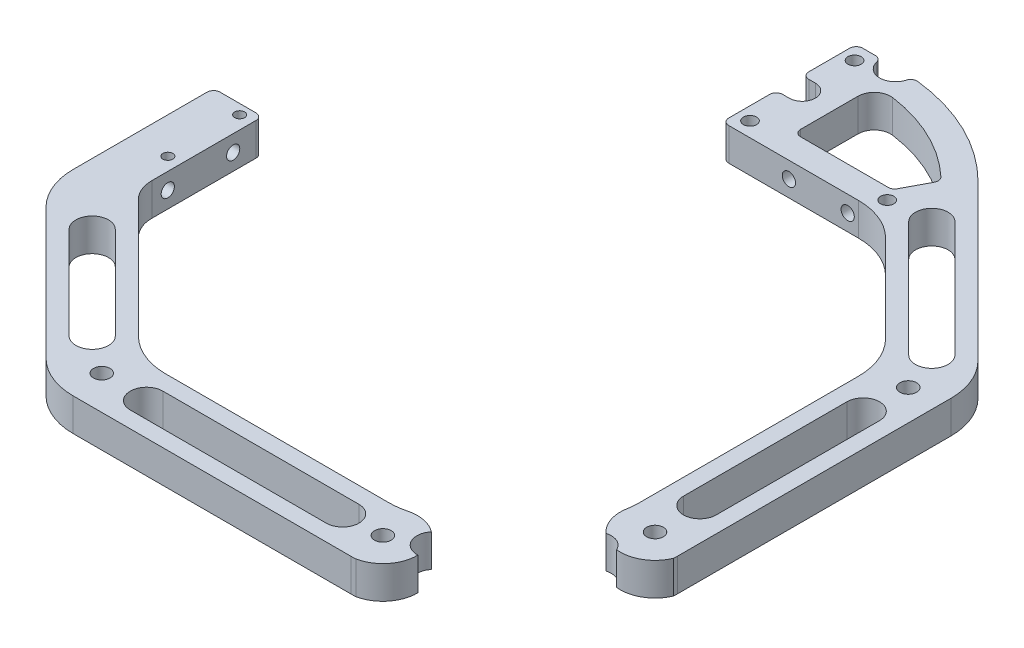
from build123d import *
from OCP.BRepFilletAPI import BRepFilletAPI_MakeFillet

# Parameters (mm, degrees)
EXTRUDE_1_DEPTH      = 5
FILLET_1_R1          = 10
FILLET_1_R2          = 20
FILLET_2_R1          = 20
FILLET_2_R2          = 60
FILLET_3_R           = 2
SKETCH_3_R           = 2.025
CUT_EXTRUDE_1_DEPTH  = 20
SKETCH_4_R           = 4.8
CUT_EXTRUDE_2_DEPTH  = 25
FILLET_4_R           = 2
SKETCH_5_R           = 1.525
CUT_EXTRUDE_3_DEPTH  = 20
CUT_EXTRUDE_4_DEPTH  = 20
CUT_EXTRUDE_5_DEPTH  = 20
FILLET_5_R           = 5
FILLET_6_R           = 2
SKETCH_8_R           = 2.55
CUT_EXTRUDE_6_DEPTH  = 25
SKETCH_9_R           = 2.025
CUT_EXTRUDE_7_DEPTH  = 17
CUT_EXTRUDE_START    = -10
CUT_EXTRUDE_10_DEPTH = 10
SKETCH_17_R          = 2.025
CUT_EXTRUDE_11_DEPTH = 8


with BuildPart() as part:
    # 草图2 → 凸台-拉伸1 (new, symmetric)
    with BuildSketch(Plane(origin=(0, 0, 0), x_dir=(1, 0, 0), z_dir=(0, 1, 0))):
        Polygon((0, -69), (0, -107), (45, -152), (130, -152), (160, -122), (160, -38.3), (121.7, 0), (71.7, 0), (71.7, 41), (108.984271247, 41), (180, -30.015728753), (180, -130.284271247), (138.284271247, -172), (36.715728753, -172), (-15, -120.284271247), (-15, -69), align=None)
    extrude(amount=EXTRUDE_1_DEPTH, both=True)

    # 圆角1: one fillet with a radius per group of edges: ONE call of the kernel's fillet builder (fillet() takes one radius for all edges)
    fillet_1_edges_1 = [part.edges().sort_by_distance(p)[0] for p in [
        (0, 0, 107),
    ]]
    fillet_1_edges_2 = [part.edges().sort_by_distance(p)[0] for p in [
        (45, 0, 152),
        (130, 0, 152),
        (160, 0, 122),
        (160, 0, 38.3),
        (121.7, 0, 0),
    ]]
    fillet_1 = BRepFilletAPI_MakeFillet(part.part.solid().wrapped)
    for e in fillet_1_edges_1:
        fillet_1.Add(FILLET_1_R1, e.wrapped)
    for e in fillet_1_edges_2:
        fillet_1.Add(FILLET_1_R2, e.wrapped)
    add(Compound.cast(fillet_1.Shape()), mode=Mode.REPLACE)

    # 圆角2: one fillet with a radius per group of edges: ONE call of the kernel's fillet builder (fillet() takes one radius for all edges)
    fillet_2_edges_1 = [part.edges().sort_by_distance(p)[0] for p in [
        (36.715728753, 0, 172),
        (-15, 0, 120.284271247),
        (138.284271247, 0, 172),
        (180, 0, 130.284271247),
        (180, 0, 30.015728753),
    ]]
    fillet_2_edges_2 = [part.edges().sort_by_distance(p)[0] for p in [
        (108.984271247, 0, -41),
    ]]
    fillet_2 = BRepFilletAPI_MakeFillet(part.part.solid().wrapped)
    for e in fillet_2_edges_1:
        fillet_2.Add(FILLET_2_R1, e.wrapped)
    for e in fillet_2_edges_2:
        fillet_2.Add(FILLET_2_R2, e.wrapped)
    add(Compound.cast(fillet_2.Shape()), mode=Mode.REPLACE)

    # 圆角3
    fillet_3_edges = [part.edges().sort_by_distance(p)[0] for p in [
        (71.7, 0, 0),
        (71.7, 0, -41),
        (-15, 0, 69),
        (0, 0, 69),
    ]]
    fillet(fillet_3_edges, radius=FILLET_3_R)

    # 草图3 → 切除-拉伸1 (cut, symmetric)
    with BuildSketch(Plane(origin=(0, 5, 0), x_dir=(1, 0, 0), z_dir=(0, 1, 0))):
        with Locations(Location((75.7, 4.5, 0), (0, 0, 90))):
            Circle(SKETCH_3_R)
        with Locations(Location((117.7, 4.5, 0), (0, 0, 90))):
            Circle(SKETCH_3_R)
        with Locations(Location((75.7, 36.5, 0), (0, 0, 90))):
            Circle(SKETCH_3_R)
    extrude(amount=CUT_EXTRUDE_1_DEPTH, both=True, mode=Mode.SUBTRACT)

    # 草图4 → 切除-拉伸2 (cut, symmetric)
    with BuildSketch(Plane(origin=(0, 5, 0), x_dir=(1, 0, 0), z_dir=(0, 1, 0))):
        with Locations((84.2, 40.5)):
            Circle(SKETCH_4_R)
        with BuildLine():
            Line((75.7, 24.5), (71.7, 24.5))
            Line((71.7, 24.5), (71.7, 16.5))
            Line((71.7, 16.5), (75.7, 16.5))
            ThreePointArc((75.7, 16.5), (79.7, 20.5), (75.7, 24.5))
        make_face()
    extrude(amount=CUT_EXTRUDE_2_DEPTH, both=True, mode=Mode.SUBTRACT)

    # 圆角4
    fillet_4_edges = [part.edges().sort_by_distance(p)[0] for p in [
        (88.990431478, 0, -40.802929459),
        (79.426112695, 0, -41),
        (71.7, 0, -16.5),
        (71.7, 0, -24.5),
    ]]
    fillet(fillet_4_edges, radius=FILLET_4_R)

    # 草图5 → 切除-拉伸3 (cut, symmetric)
    with BuildSketch(Plane.XZ.offset(5)):
        with Locations(Location((-4, 72, 0), (0, 0, 270))):
            Circle(SKETCH_5_R)
        with Locations(Location((-4, 94, 0), (0, 0, 270))):
            Circle(SKETCH_5_R)
    extrude(amount=CUT_EXTRUDE_3_DEPTH, both=True, mode=Mode.SUBTRACT)

    # 草图6 → 切除-拉伸4 (cut, symmetric)
    with BuildSketch(Plane.XZ.offset(5)):
        with BuildLine():
            Line((0.251262658, 128.464466094), (28.535533906, 156.748737342))
            ThreePointArc((28.535533906, 156.748737342), (35.606601718, 156.748737342), (35.606601718, 149.67766953))
            Line((35.606601718, 149.67766953), (7.32233047, 121.393398282))
            ThreePointArc((7.32233047, 121.393398282), (0.251262658, 121.393398282), (0.251262658, 128.464466094))
        make_face()
        with BuildLine():
            Line((57.5, 167), (117.5, 167))
            ThreePointArc((117.5, 167), (122.5, 162), (117.5, 157))
            Line((117.5, 157), (57.5, 157))
            ThreePointArc((57.5, 157), (52.5, 162), (57.5, 167))
        make_face()
        with BuildLine():
            Line((143.232233047, 159.980970389), (167.980970389, 135.232233047))
            ThreePointArc((167.980970389, 135.232233047), (167.980970389, 128.161165235), (160.909902577, 128.161165235))
            Line((160.909902577, 128.161165235), (136.161165235, 152.909902577))
            ThreePointArc((136.161165235, 152.909902577), (136.161165235, 159.980970389), (143.232233047, 159.980970389))
        make_face()
        with BuildLine():
            Line((165, 55.15), (165, 105.15))
            ThreePointArc((165, 105.15), (170, 110.15), (175, 105.15))
            Line((175, 105.15), (175, 55.15))
            ThreePointArc((175, 55.15), (170, 50.15), (165, 55.15))
        make_face()
        with BuildLine():
            Line((126.707864376, -2.063203436), (162.063203436, 33.292135624))
            ThreePointArc((162.063203436, 33.292135624), (169.134271247, 33.292135624), (169.134271247, 26.221067812))
            Line((169.134271247, 26.221067812), (133.778932188, -9.134271247))
            ThreePointArc((133.778932188, -9.134271247), (126.707864376, -9.134271247), (126.707864376, -2.063203436))
        make_face()
    extrude(amount=CUT_EXTRUDE_4_DEPTH, both=True, mode=Mode.SUBTRACT)

    # 草图7 → 切除-拉伸5 (cut, symmetric)
    with BuildSketch(Plane.XZ.offset(5)):
        with BuildLine():
            Line((85.7, -8), (85.7, -32.97633764))
            ThreePointArc((85.7, -32.97633764), (104.753386657, -28.736108325), (120.901010127, -17.769552622))
            Line((120.901010127, -17.769552622), (115.7, -8))
            Line((115.7, -8), (85.7, -8))
        make_face()
    extrude(amount=CUT_EXTRUDE_5_DEPTH, both=True, mode=Mode.SUBTRACT)

    # 圆角5
    fillet_5_edges = [part.edges().sort_by_distance(p)[0] for p in [
        (85.7, 0, -32.97633764),
    ]]
    fillet(fillet_5_edges, radius=FILLET_5_R)

    # 圆角6
    fillet_6_edges = [part.edges().sort_by_distance(p)[0] for p in [
        (85.7, 0, -8),
        (115.7, 0, -8),
        (120.901010127, 0, -17.769552622),
    ]]
    fillet(fillet_6_edges, radius=FILLET_6_R)

    # 草图8 → 切除-拉伸6 (cut, symmetric)
    with BuildSketch(Plane.XZ.offset(5)):
        with Locations(Location((129.418903719, 161.588083739, 0), (0, 0, 270))):
            Circle(SKETCH_8_R)
        with Locations(Location((43.400300748, 161.615457479, 0), (0, 0, 270))):
            Circle(SKETCH_8_R)
        with Locations(Location((170.165348997, 119.039058113, 0), (0, 0, 270))):
            Circle(SKETCH_8_R)
        with Locations(Location((170.614159104, 41.965432639, 0), (0, 0, 270))):
            Circle(SKETCH_8_R)
    extrude(amount=CUT_EXTRUDE_6_DEPTH, both=True, mode=Mode.SUBTRACT)

    # 草图9 → 切除-拉伸7 (cut)
    with BuildSketch(Plane(origin=(0, 0, 0), x_dir=(0, 0, -1), z_dir=(1, 0, 0))):
        with Locations((-98, 0)):
            Circle(SKETCH_9_R)
        with Locations((-78, 0)):
            Circle(SKETCH_9_R)
    extrude(amount=-CUT_EXTRUDE_7_DEPTH, mode=Mode.SUBTRACT)

    # 草图15 → 切除-拉伸10 (cut)
    with BuildSketch(Plane(origin=(0, 5, 0), x_dir=(1, 0, 0), z_dir=(0, 1, 0)).offset(CUT_EXTRUDE_START)):
        with BuildLine():
            Line((144.142135624, -166.142135624), (174.142135624, -136.142135624))
            ThreePointArc((174.142135624, -136.142135624), (178.24815418, -130.18565019), (179.966442496, -123.1580907))
            ThreePointArc((179.966442496, -123.1580907), (167.163360508, -129.237878062), (159.695667547, -117.191455996))
            ThreePointArc((159.695667547, -117.191455996), (157.739568704, -122.95194563), (154.142135624, -127.857864376))
            Line((154.142135624, -127.857864376), (135.857864376, -146.142135624))
            ThreePointArc((135.857864376, -146.142135624), (131.65412483, -149.355929345), (126.754700135, -151.354812513))
            ThreePointArc((126.754700135, -151.354812513), (139.712599821, -159.167827292), (131.593845924, -171.936390224))
            ThreePointArc((131.593845924, -171.936390224), (138.384427554, -170.15768087), (144.142135624, -166.142135624))
        make_face()
    extrude(amount=CUT_EXTRUDE_10_DEPTH, mode=Mode.SUBTRACT)


with BuildPart() as cut_extrude_10_piece_1:
    # of the separate pieces the step leaves, piece 1, a body of its own (cut_extrude_10_pieces)
    add(part.part.solids().sort_by_distance((71.7, -5, -14.5))[0])

    # 草图17 → 切除-拉伸11 (cut)
    with BuildSketch(Plane(origin=(0, 0, -8), x_dir=(-1, 0, 0), z_dir=(0, 0, -1))):
        with Locations((-110.099489323, 0)):
            Circle(SKETCH_17_R)
        with Locations((-92.099489323, 0)):
            Circle(SKETCH_17_R)
    extrude(amount=-CUT_EXTRUDE_11_DEPTH, mode=Mode.SUBTRACT)


with BuildPart() as cut_extrude_10_piece_2:
    # of the separate pieces the step leaves, piece 2, a body of its own (cut_extrude_10_pieces)
    add(part.part.solids().sort_by_distance((126.754700135, -5, 151.354812513))[0])


solid = Compound([cut_extrude_10_piece_1.part, cut_extrude_10_piece_2.part])
